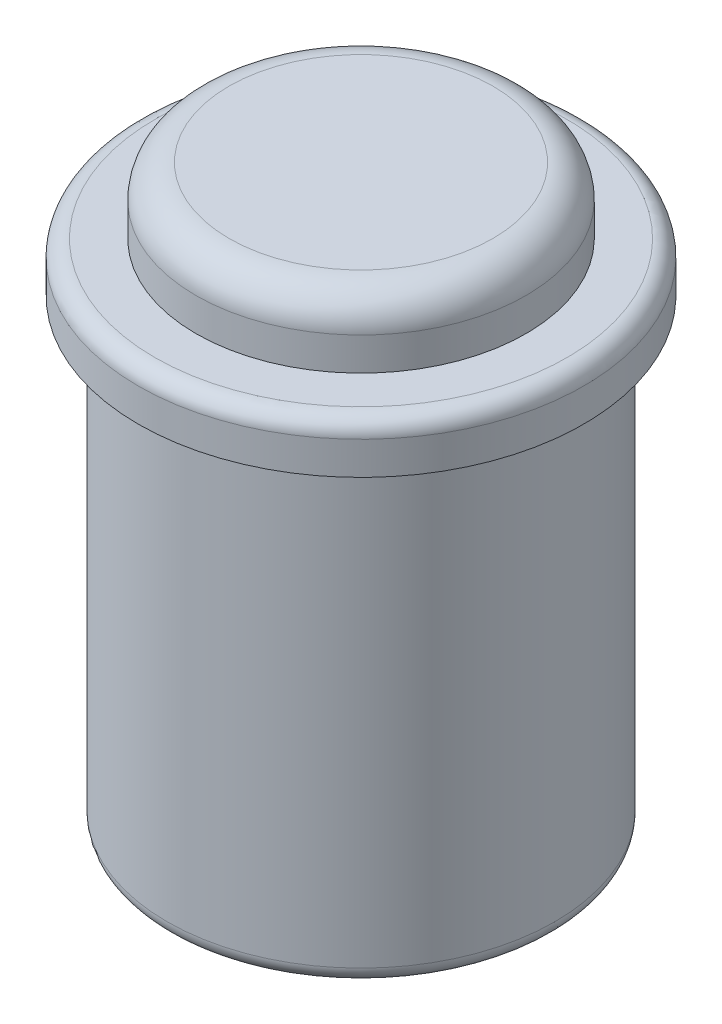
from build123d import *

# Parameters (mm, degrees)
ESQUISSE1_R        = 13.5
BOSS_EXTRU_1_DEPTH = 3
ESQUISSE2_R        = 10
BOSS_EXTRU_2_DEPTH = 4
ESQUISSE3_R        = 11.75
BOSS_EXTRU_3_DEPTH = 28
ESQUISSE4_W        = 1.593426019
ESQUISSE4_H        = 0.348561941
BOSS_EXTRU_4_DEPTH = 2.8
CONG_1_R           = 2
CONG_2_R           = 1
CONG_3_R           = 1


with BuildPart() as part:
    # Esquisse1 → Boss.-Extru.1 (new body)
    with BuildSketch(Plane(origin=(0, 0, 0), x_dir=(1, 0, 0), z_dir=(0, 1, 0))):
        with Locations(Location((0, 0, 0), (0, 0, 270))):
            Circle(ESQUISSE1_R)
    extrude(amount=BOSS_EXTRU_1_DEPTH)

    # Esquisse2 → Boss.-Extru.2 (add)
    with BuildSketch(Plane(origin=(0, 3, 0), x_dir=(1, 0, 0), z_dir=(0, 1, 0))):
        with Locations(Location((0, 0, 0), (0, 0, 270))):
            Circle(ESQUISSE2_R)
    extrude(amount=BOSS_EXTRU_2_DEPTH)

    # Esquisse3 → Boss.-Extru.3 (add)
    with BuildSketch(Plane.XZ):
        with Locations(Location((0, 0, 0), (0, 0, 270))):
            Circle(ESQUISSE3_R)
    extrude(amount=BOSS_EXTRU_3_DEPTH)

    # Esquisse4 → Boss.-Extru.4 (add)
    with BuildSketch(Plane.XZ.offset(28)):
        with Locations((-6.369565613, -2.707032561)):
            Rectangle(ESQUISSE4_W, ESQUISSE4_H)
    boss_extru_4 = extrude(amount=BOSS_EXTRU_4_DEPTH)

    # Symétrie1: Boss.-Extru.4 across plane
    add(boss_extru_4.mirror(Plane(origin=(0, 0, 0), x_dir=(0, 0, 1), z_dir=(1, 0, 0))))

    # Congé1
    cong_1_edges = [part.edges().sort_by_distance(p)[0] for p in [
        (0, 7, -10),
    ]]
    fillet(cong_1_edges, radius=CONG_1_R)

    # Congé2
    cong_2_edges = [part.edges().sort_by_distance(p)[0] for p in [
        (0, 3, -13.5),
    ]]
    fillet(cong_2_edges, radius=CONG_2_R)

    # Congé3
    cong_3_edges = [part.edges().sort_by_distance(p)[0] for p in [
        (0, -28, 11.75),
    ]]
    fillet(cong_3_edges, radius=CONG_3_R)


solid = part.part
